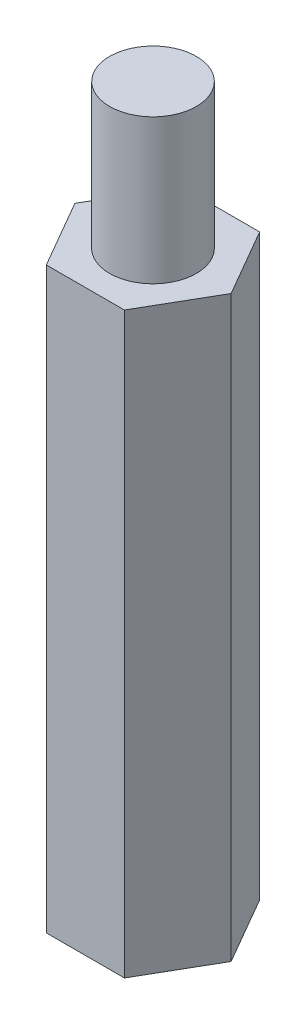
from build123d import *

# Parameters (mm, degrees)
EXTRUDE_1_DEPTH          = 20
SKETCH_2_R               = 1.5
EXTRUDE_2_DEPTH          = 25
CUT_EXTRUDE_2_DEPTH      = 5
CUT_EXTRUDE_2_DEPTH_BACK = 1
SKETCH_3_R               = 1.5


with BuildPart() as part:
    # 草图1 → 凸台-拉伸1 (new body)
    with BuildSketch(Plane(origin=(0, 0, 0), x_dir=(1, 0, 0), z_dir=(0, 1, 0))):
        Polygon((2.7, 0), (1.35, 2.33826859), (-1.35, 2.33826859), (-2.7, 0), (-1.35, -2.33826859), (1.35, -2.33826859), align=None)
    extrude(amount=EXTRUDE_1_DEPTH)

    # 草图2 → 凸台-拉伸2 (add)
    with BuildSketch(Plane(origin=(0, 0, 0), x_dir=(1, 0, 0), z_dir=(0, 1, 0))):
        with Locations(Location((0, 0, 0), (0, 0, 270))):
            Circle(SKETCH_2_R)
    extrude(amount=EXTRUDE_2_DEPTH)

    # 草图3 → 切除-拉伸2 (cut, two sides: drawn at the far end of the back side and taken through both)
    with BuildSketch(Plane(origin=(0, 0, 0), x_dir=(1, 0, 0), z_dir=(0, 1, 0)).offset(-CUT_EXTRUDE_2_DEPTH_BACK)):
        with Locations(Location((0, 0, 0), (0, 0, 270))):
            Circle(SKETCH_3_R)
    extrude(amount=CUT_EXTRUDE_2_DEPTH + CUT_EXTRUDE_2_DEPTH_BACK, mode=Mode.SUBTRACT)


solid = part.part
